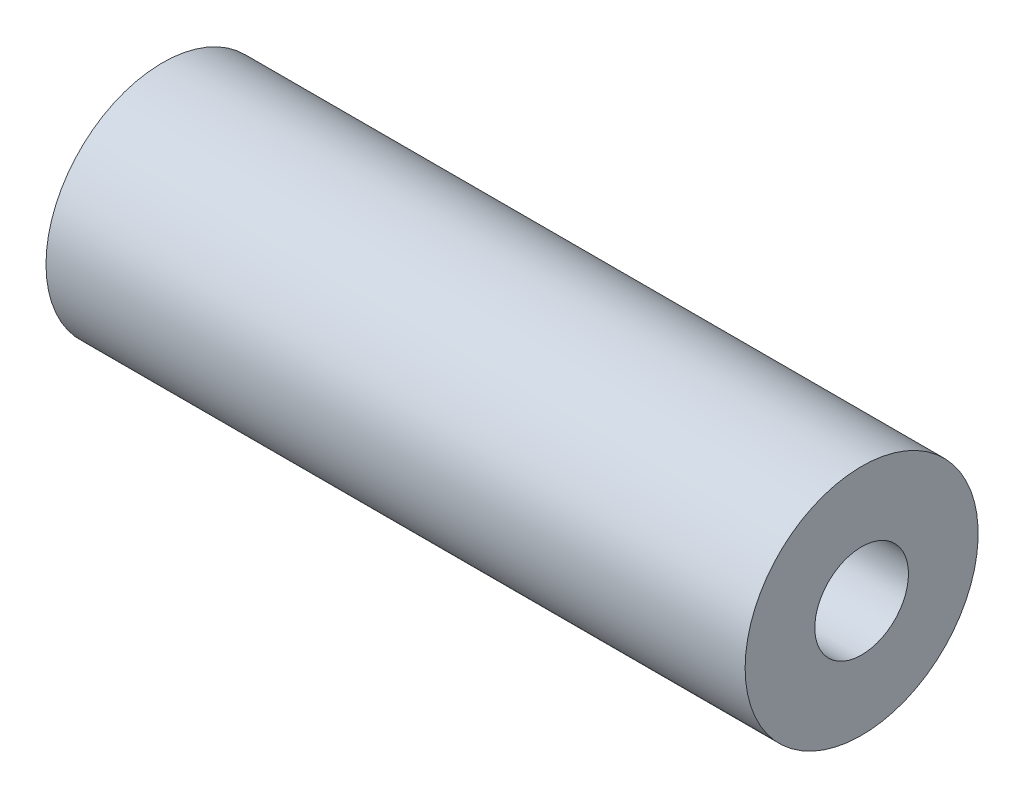
from build123d import *

# Parameters (mm, degrees)
SKETCH1_R           = 6.35
BOSS_EXTRUDE1_DEPTH = 38.1


with BuildPart() as part:
    # Sketch1 → Boss-Extrude1 (new body)
    with BuildSketch(Plane(origin=(0, 0, 0), x_dir=(0, 0, -1), z_dir=(1, 0, 0))):
        with Locations(Location((0, 0, 0), (0, 0, 180))):
            Circle(SKETCH1_R)
    extrude(amount=BOSS_EXTRUDE1_DEPTH)

    # Sketch4 → Tap Drill for 1/4-20 Tap1 (revolve, cut)
    with BuildSketch(Plane.ZX):
        Polygon((0, 0), (0, 14.233816902), (2.5527, 12.7), (2.5527, 0), align=None)
    tap_drill_for_1_4_20_tap1 = revolve(axis=Axis((-6.35, 0, 0), (1, 0, 0)), mode=Mode.SUBTRACT)

    # Mirror1: Tap Drill for 1/4-20 Tap1 across plane
    add(tap_drill_for_1_4_20_tap1.mirror(Plane.ZY.offset(-19.05)), mode=Mode.SUBTRACT)


solid = part.part
